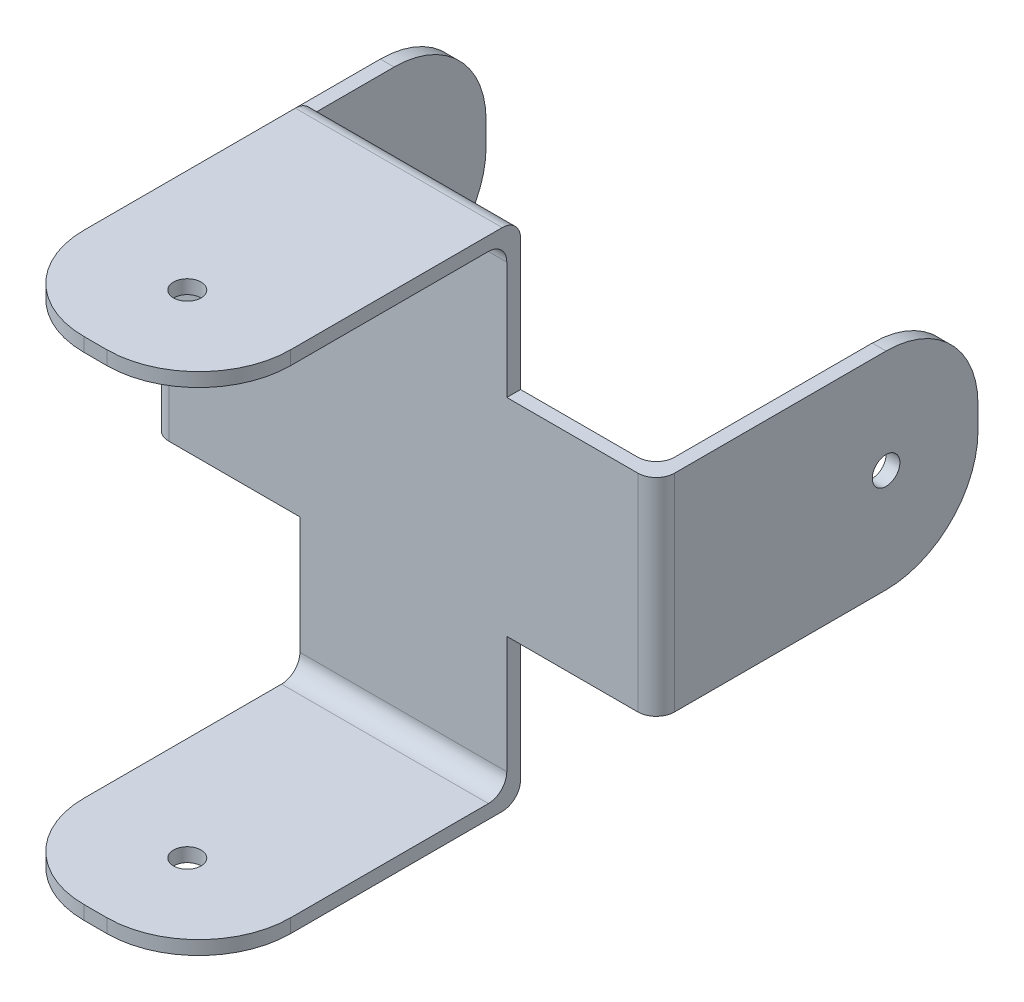
from build123d import *

# Parameters (mm, degrees)
EXTRUDE_1_DEPTH     = 11.25
SKETCH_2_R          = 1.5
CUT_EXTRUDE_1_DEPTH = 67.155593112
SKETCH_3_W          = 55
SKETCH_3_H          = 22.5
EXTRUDE_1_2_DEPTH   = 1.5
SKETCH_4_W          = 1.5
SKETCH_4_H          = 22.5
EXTRUDE_2_DEPTH     = 35
SKETCH_5_R          = 1.5
CUT_EXTRUDE_2_DEPTH = 71.75485849
FILLET_1_R          = 10
FILLET_2_R          = 2


with BuildPart() as part:
    # 草图1 → Extrude 1 (new, symmetric)
    with BuildSketch(Plane(origin=(0, 0, 0), x_dir=(0, 0, -1), z_dir=(1, 0, 0))):
        Polygon((-35, 27.5), (0, 27.5), (0, -27.5), (-35, -27.5), (-35, -26), (-1.5, -26), (-1.5, 26), (-35, 26), align=None)
    extrude(amount=EXTRUDE_1_DEPTH, both=True)

    # 草图2 → 切除-拉伸1 (cut, through all)
    with BuildSketch(Plane(origin=(0, 27.5, 0), x_dir=(1, 0, 0), z_dir=(0, 1, 0))):
        with Locations(Location((0, -25, 0), (0, 0, 270))):
            Circle(SKETCH_2_R)
    extrude(amount=-CUT_EXTRUDE_1_DEPTH, mode=Mode.SUBTRACT)

    # 草图3 → Extrude 1 2 (add)
    with BuildSketch(Plane(origin=(0, 0, 0), x_dir=(-1, 0, 0), z_dir=(0, 0, -1))):
        Rectangle(SKETCH_3_W, SKETCH_3_H)
    extrude(amount=-EXTRUDE_1_2_DEPTH)

    # 草图4 → 凸台-拉伸2 (add)
    with BuildSketch(Plane.XY.offset(1.5)):
        with Locations((26.75, 0)):
            Rectangle(SKETCH_4_W, SKETCH_4_H)
    extrude_2 = extrude(amount=-EXTRUDE_2_DEPTH)

    # 镜向1: 凸台-拉伸2 across plane
    add(extrude_2.mirror(Plane(origin=(0, 0, 0), x_dir=(0, 0, 1), z_dir=(1, 0, 0))))

    # 草图5 → 切除-拉伸2 (cut, through all)
    with BuildSketch(Plane(origin=(27.5, 0, 0), x_dir=(0, 0, -1), z_dir=(1, 0, 0))):
        with Locations((23.5, 0)):
            Circle(SKETCH_5_R)
    extrude(amount=-CUT_EXTRUDE_2_DEPTH, mode=Mode.SUBTRACT)

    # 圆角1
    fillet_1_edges = [part.edges().sort_by_distance(p)[0] for p in [
        (11.25, 26.75, 35),
        (11.25, -26.75, 35),
        (-11.25, 26.75, 35),
        (26.75, 11.25, -33.5),
        (26.75, -11.25, -33.5),
        (-11.25, -26.75, 35),
        (-26.75, -11.25, -33.5),
        (-26.75, 11.25, -33.5),
    ]]
    fillet(fillet_1_edges, radius=FILLET_1_R)

    # 圆角2
    fillet_2_edges = [part.edges().sort_by_distance(p)[0] for p in [
        (0, -26, 1.5),
        (0, 26, 1.5),
        (0, 27.5, 0),
        (0, -27.5, 0),
        (27.5, 0, 1.5),
        (-27.5, 0, 1.5),
        (26, 0, 0),
        (-26, 0, 0),
    ]]
    fillet(fillet_2_edges, radius=FILLET_2_R)


solid = part.part
